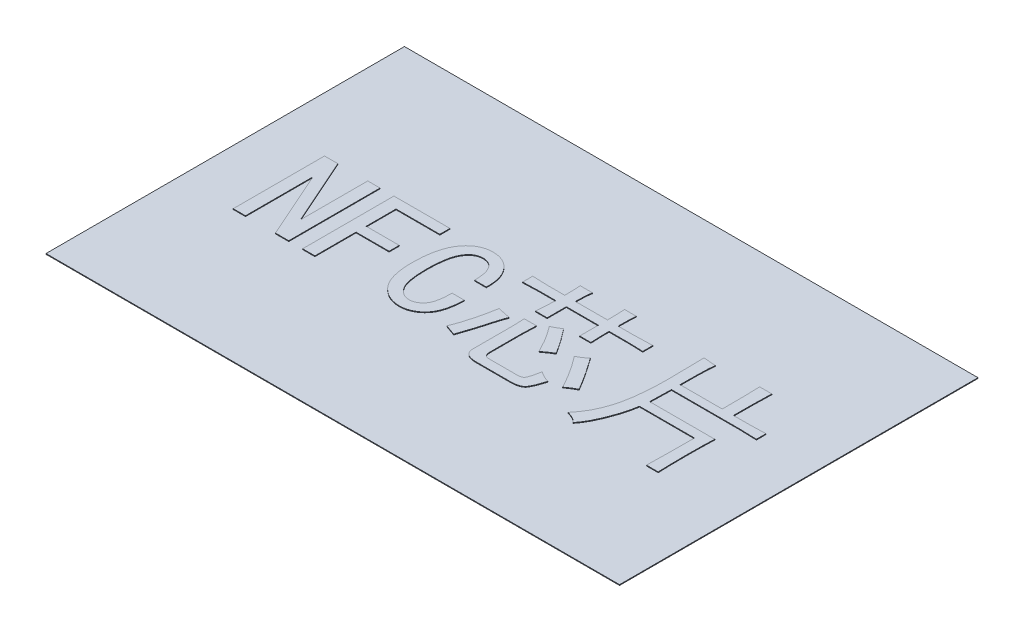
from build123d import *

# Parameters (mm, degrees)
SKETCH_1_W      = 80
SKETCH_1_H      = 50
EXTRUDE_1_DEPTH = 0.1
EXTRUDE_2_DEPTH = 0.1


with BuildPart() as part:
    # 草图1 → 凸台-拉伸1 (new body)
    with BuildSketch(Plane(origin=(0, 0, 0), x_dir=(1, 0, 0), z_dir=(0, 1, 0))):
        with Locations((40, -25)):
            Rectangle(SKETCH_1_W, SKETCH_1_H)
    extrude(amount=EXTRUDE_1_DEPTH)

    # 草图2 → 凸台-拉伸2 (add)
    with BuildSketch(Plane(origin=(0, 0.1, 0), x_dir=(1, 0, 0), z_dir=(0, 1, 0))):
        Polygon((15.488715278, -31.627687926), (13.62715491, -31.627687926), (9.5317221, -22.394348501), (9.457259686, -22.394348501), (9.457259686, -31.627687926), (7.744624147, -31.627687926), (7.744624147, -18.89461501), (9.606184515, -18.89461501), (13.701617325, -28.127954435), (13.776079739, -28.127954435), (13.776079739, -18.89461501), (15.488715278, -18.89461501), align=None)
        Polygon((25.243291606, -20.309400889), (19.137373599, -20.309400889), (19.137373599, -24.479296114), (23.754043311, -24.479296114), (23.754043311, -25.894081993), (19.137373599, -25.894081993), (19.137373599, -31.627687926), (17.42473806, -31.627687926), (17.42473806, -18.89461501), (25.243291606, -18.89461501), align=None)
        with BuildLine():
            add(Edge.make_bspline(
                [(34.923405519, -26.564243726), (34.913857462, -26.791460973), (34.895420979, -27.230198121), (34.829895413, -27.862190697), (34.732211137, -28.443068093), (34.600634036, -28.972835897), (34.435962132, -29.452556673), (34.2385183, -29.882743661), (34.006608285, -30.261132949), (33.74177677, -30.587187998), (33.451938828, -30.864598328), (33.151947009, -31.110043596), (32.835369864, -31.313750998), (32.507457028, -31.486389748), (32.161794857, -31.613761043), (31.80388749, -31.709313148), (31.431854495, -31.765084598), (31.17932293, -31.772735756), (31.051359954, -31.776612756)],
                knots=[0, 0, 0, 0, 1.494742256, 2.886219951, 4.173809575, 5.363956482, 6.470526693, 7.503352352, 8.469361244, 9.380145438, 10.256246157, 11.102836884, 11.924181916, 12.726930422, 13.533966696, 14.340165361, 15.1589274, 16, 16, 16, 16], degree=3))
            add(Edge.make_bspline(
                [(31.051359954, -31.776612756), (30.904895704, -31.772771261), (30.615805516, -31.765188942), (30.191476375, -31.692928182), (29.782033129, -31.580549345), (29.390724056, -31.418997258), (29.012976499, -31.216129126), (28.654890641, -30.964030415), (28.314722051, -30.664883069), (27.986470319, -30.326762704), (27.687387638, -29.934712938), (27.430771498, -29.485071058), (27.211800966, -28.982337137), (27.038875313, -28.423854033), (26.900396079, -27.812551757), (26.803878481, -27.14680976), (26.741852627, -26.426608894), (26.735712722, -25.928232707), (26.7325399, -25.670694749)],
                knots=[0, 0, 0, 0, 0.834912197, 1.647944286, 2.448293278, 3.25272125, 4.057593572, 4.889800151, 5.744779857, 6.638682353, 7.574302, 8.549391203, 9.585101031, 10.696366523, 11.879553958, 13.157474301, 14.531113079, 16, 16, 16, 16], degree=3))
            add(Edge.make_bspline(
                [(26.7325399, -25.670694749), (26.736020783, -25.38837311), (26.742763634, -24.841485298), (26.800868705, -24.048657745), (26.896735533, -23.312078552), (27.025987051, -22.629899864), (27.20079474, -22.005306529), (27.407806169, -21.432872596), (27.65901477, -20.918296799), (27.947068595, -20.458891977), (28.267652076, -20.057905475), (28.60713458, -19.704512979), (28.974930329, -19.412196611), (29.359708521, -19.164444747), (29.770573459, -18.976663991), (30.203512661, -18.843517921), (30.657571288, -18.761612285), (30.968283122, -18.751047042), (31.125822368, -18.74569018)],
                knots=[0, 0, 0, 0, 1.47527999, 2.857778281, 4.151479961, 5.355606635, 6.48275776, 7.537632238, 8.53243139, 9.469452065, 10.365307734, 11.211246795, 12.024566517, 12.814930656, 13.597414655, 14.376958224, 15.177074222, 16, 16, 16, 16], degree=3))
            add(Edge.make_bspline(
                [(31.125822368, -18.74569018), (31.259331106, -18.74927784), (31.52212589, -18.756339686), (31.907755315, -18.815825614), (32.275387121, -18.91254009), (32.627171293, -19.044868766), (32.959430332, -19.220716966), (33.274362056, -19.433827452), (33.572478882, -19.684727125), (33.849198441, -19.972852323), (34.10030551, -20.295878075), (34.320726355, -20.65035987), (34.498860607, -21.039463141), (34.643023241, -21.458810009), (34.749537015, -21.909742895), (34.820179246, -22.391324676), (34.856826195, -22.903994762), (34.85162315, -23.255674833), (34.848943104, -23.436822308)],
                knots=[0, 0, 0, 0, 0.945956135, 1.861993012, 2.758160538, 3.636767115, 4.519928897, 5.416356982, 6.327443843, 7.276805287, 8.242661636, 9.222809965, 10.22861537, 11.269278515, 12.361406108, 13.507821131, 14.716299423, 16, 16, 16, 16], degree=3))
            Line((34.848943104, -23.436822308), (33.210769981, -23.436822308))
            add(Edge.make_bspline(
                [(33.210769981, -23.436822308), (33.209283385, -23.304407701), (33.206410615, -23.04852313), (33.181493119, -22.676586118), (33.139748552, -22.330740642), (33.087682562, -22.009148313), (33.010393786, -21.715387949), (32.925884595, -21.444048868), (32.816252734, -21.200713687), (32.695668408, -20.980583563), (32.557990602, -20.786035185), (32.401752936, -20.618583478), (32.229343315, -20.476643754), (32.040732764, -20.359219978), (31.833857253, -20.270976702), (31.612346125, -20.208100944), (31.374530046, -20.168184166), (31.210561468, -20.163102348), (31.125822368, -20.16047606)],
                knots=[0, 0, 0, 0, 1.447060158, 2.796371029, 4.07121282, 5.253842581, 6.352813545, 7.388565209, 8.355623335, 9.26412738, 10.128389993, 10.952966403, 11.759535034, 12.562529072, 13.372531918, 14.208837792, 15.074325855, 16, 16, 16, 16], degree=3))
            add(Edge.make_bspline(
                [(31.125822368, -20.16047606), (31.029011668, -20.164088534), (30.838197872, -20.171208716), (30.560041293, -20.230575695), (30.298054825, -20.328942809), (30.048743495, -20.46222568), (29.816487139, -20.638133619), (29.601023894, -20.852586715), (29.400776027, -21.1045337), (29.215200393, -21.395679911), (29.049070526, -21.732804812), (28.906025501, -22.120131682), (28.786591659, -22.559691023), (28.688445952, -23.051845075), (28.612588704, -23.595205469), (28.558364109, -24.190645266), (28.52537353, -24.838363326), (28.521597906, -25.288229433), (28.519637853, -25.52176992)],
                knots=[0, 0, 0, 0, 0.702271953, 1.384177325, 2.053558723, 2.728373715, 3.429090246, 4.160530408, 4.929691837, 5.760909872, 6.662226506, 7.652627398, 8.753591582, 9.965523965, 11.293414481, 12.734409524, 14.304723168, 16, 16, 16, 16], degree=3))
            add(Edge.make_bspline(
                [(28.519637853, -25.52176992), (28.521596446, -25.736927624), (28.525365492, -26.150969641), (28.558278508, -26.746348464), (28.612615797, -27.292190469), (28.68797312, -27.787960129), (28.786930297, -28.235036927), (28.906022888, -28.632604584), (29.048664624, -28.980923695), (29.215534257, -29.280373422), (29.402383849, -29.534742073), (29.598901027, -29.756039084), (29.809504745, -29.941621627), (30.03184869, -30.095963719), (30.268532082, -30.215593561), (30.517869035, -30.301752662), (30.780858253, -30.352678917), (30.960127605, -30.358741536), (31.051359954, -30.361826876)],
                knots=[0, 0, 0, 0, 1.695965335, 3.263656815, 4.698586284, 6.018671717, 7.214194339, 8.305339643, 9.286425595, 10.175404576, 11.000155583, 11.769871946, 12.504076626, 13.207599708, 13.897898414, 14.587702459, 15.281264647, 16, 16, 16, 16], degree=3))
            add(Edge.make_bspline(
                [(31.051359954, -30.361826876), (31.118675803, -30.360181663), (31.253527539, -30.35688586), (31.452186082, -30.315219707), (31.647611713, -30.254639619), (31.838155254, -30.169568629), (32.020784309, -30.055959534), (32.202593294, -29.924442034), (32.373991902, -29.761305607), (32.549309886, -29.580656115), (32.709640118, -29.35936981), (32.842080881, -29.09072796), (32.958731012, -28.779667853), (33.049041267, -28.423113385), (33.124522252, -28.022655667), (33.174638864, -27.576536203), (33.204396208, -27.08497277), (33.208586494, -26.742631748), (33.210769981, -26.564243726)],
                knots=[0, 0, 0, 0, 0.660928196, 1.324016798, 1.987351856, 2.671191622, 3.368874025, 4.099346338, 4.873489474, 5.6921189, 6.572789567, 7.547167455, 8.628526434, 9.834544533, 11.159025956, 12.633584625, 14.245818809, 16, 16, 16, 16], degree=3))
            Line((33.210769981, -26.564243726), (34.923405519, -26.564243726))
        make_face()
        with BuildLine():
            add(Edge.make_bspline(
                [(41.327173185, -18.969077424), (41.326045629, -18.754871808), (41.323887059, -18.344800596), (41.309613439, -17.758247124), (41.290104372, -17.227490759), (41.264716916, -16.893265571), (41.25271077, -16.735204983)],
                knots=[0, 0, 0, 0, 1.149734275, 2.201029726, 3.149237371, 4, 4, 4, 4], degree=3))
            Line((41.25271077, -16.735204983), (42.965346308, -16.735204983))
            add(Edge.make_bspline(
                [(42.965346308, -16.735204983), (42.941186205, -16.883877954), (42.8890439, -17.204743772), (42.852231445, -17.727627015), (42.818215598, -18.323288501), (42.817042287, -18.745618959), (42.816421479, -18.969077424)],
                knots=[0, 0, 0, 0, 0.806002438, 1.739513442, 2.803958259, 4, 4, 4, 4], degree=3))
            Line((42.816421479, -18.969077424), (47.284166362, -18.969077424))
            add(Edge.make_bspline(
                [(47.284166362, -18.969077424), (47.283084621, -18.722696455), (47.281042044, -18.257472289), (47.266734208, -17.601064604), (47.247985924, -17.02797831), (47.221767659, -16.674474234), (47.209703947, -16.511817739)],
                knots=[0, 0, 0, 0, 1.202339285, 2.270294216, 3.204117013, 4, 4, 4, 4], degree=3))
            Line((47.209703947, -16.511817739), (48.847877071, -16.511817739))
            add(Edge.make_bspline(
                [(48.847877071, -16.511817739), (48.842345864, -16.584438233), (48.830656742, -16.737907408), (48.812448877, -16.981349864), (48.803995577, -17.250024059), (48.791506238, -17.544105488), (48.783595856, -17.864061071), (48.779266198, -18.209746543), (48.771783687, -18.581111475), (48.772858137, -18.836695621), (48.773414656, -18.969077424)],
                knots=[0, 0, 0, 0, 0.710832898, 1.502205942, 2.382198482, 3.333912172, 4.375017415, 5.50563752, 6.708025486, 8, 8, 8, 8], degree=3))
            Line((48.773414656, -18.969077424), (50.783899854, -18.969077424))
            add(Edge.make_bspline(
                [(50.783899854, -18.969077424), (51.249145649, -18.965787152), (52.16801373, -18.959288811), (53.085880992, -18.915990371), (53.539009198, -18.89461501)],
                knots=[0, 0, 0, 0, 1.012649812, 2, 2, 2, 2], degree=3))
            Line((53.539009198, -18.89461501), (53.539009198, -20.309400889))
            add(Edge.make_bspline(
                [(53.539009198, -20.309400889), (53.323015196, -20.297484402), (52.882926548, -20.273204511), (52.20797865, -20.252894137), (51.505604342, -20.238466931), (51.027519622, -20.236129546), (50.783899854, -20.234938475)],
                knots=[0, 0, 0, 0, 0.941701369, 1.918720329, 2.939433014, 4, 4, 4, 4], degree=3))
            Line((50.783899854, -20.234938475), (48.773414656, -20.234938475))
            add(Edge.make_bspline(
                [(48.773414656, -20.234938475), (48.774608093, -20.465688664), (48.776952384, -20.918955549), (48.791364407, -21.584559947), (48.8115698, -22.222753736), (48.835950905, -22.63800184), (48.847877071, -22.84112299)],
                knots=[0, 0, 0, 0, 1.061879169, 2.085868982, 3.063691104, 4, 4, 4, 4], degree=3))
            Line((48.847877071, -22.84112299), (47.284166362, -22.84112299))
            Line((47.284166362, -22.84112299), (47.284166362, -20.234938475))
            Line((47.284166362, -20.234938475), (42.816421479, -20.234938475))
            Line((42.816421479, -20.234938475), (42.816421479, -22.915585404))
            Line((42.816421479, -22.915585404), (41.178248355, -22.915585404))
            add(Edge.make_bspline(
                [(41.178248355, -22.915585404), (41.201949892, -22.719938604), (41.251483914, -22.311054868), (41.295408881, -21.667746318), (41.32361565, -20.969712746), (41.325957934, -20.485936758), (41.327173185, -20.234938475)],
                knots=[0, 0, 0, 0, 0.880114875, 1.839358766, 2.878990995, 4, 4, 4, 4], degree=3))
            Line((41.327173185, -20.234938475), (39.018838328, -20.234938475))
            add(Edge.make_bspline(
                [(39.018838328, -20.234938475), (38.860711955, -20.236283272), (38.526024512, -20.239129646), (37.995577356, -20.254163981), (37.408947982, -20.275204852), (36.999128016, -20.297664181), (36.784965887, -20.309400889)],
                knots=[0, 0, 0, 0, 0.848878712, 1.796721432, 2.848619227, 4, 4, 4, 4], degree=3))
            Line((36.784965887, -20.309400889), (36.784965887, -18.89461501))
            add(Edge.make_bspline(
                [(36.784965887, -18.89461501), (36.989932148, -18.906385312), (37.386859779, -18.929179105), (37.964310985, -18.95022568), (38.503961559, -18.965038899), (38.851518894, -18.967765026), (39.018838328, -18.969077424)],
                knots=[0, 0, 0, 0, 1.102078905, 2.134232082, 3.101790691, 4, 4, 4, 4], degree=3))
            Line((39.018838328, -18.969077424), (41.327173185, -18.969077424))
        make_face()
        with BuildLine():
            add(Edge.make_bspline(
                [(43.039808723, -24.628220943), (43.018435396, -24.975605545), (42.975714936, -25.669948998), (42.968801104, -26.365570881), (42.965346308, -26.713168555)],
                knots=[0, 0, 0, 0, 1.000613171, 2, 2, 2, 2], degree=3))
            Line((42.965346308, -26.713168555), (42.965346308, -31.031988609))
            add(Edge.make_bspline(
                [(42.965346308, -31.031988609), (42.966916742, -31.102040287), (42.969875255, -31.234009487), (43.005689485, -31.417379444), (43.063260258, -31.57454673), (43.14606994, -31.702979834), (43.253204828, -31.805336725), (43.385119846, -31.877230199), (43.541144829, -31.918643778), (43.651796139, -31.923162101), (43.709970456, -31.925537585)],
                knots=[0, 0, 0, 0, 1.263118504, 2.379568078, 3.356679522, 4.26815605, 5.113463714, 6.004925496, 6.951100566, 8, 8, 8, 8], degree=3))
            Line((43.709970456, -31.925537585), (47.73094085, -31.925537585))
            add(Edge.make_bspline(
                [(47.73094085, -31.925537585), (47.812182317, -31.922173545), (47.963968795, -31.915888384), (48.174896189, -31.861165568), (48.348666619, -31.766394593), (48.465553561, -31.650570101), (48.542370139, -31.524572503), (48.596333328, -31.387048278), (48.661274083, -31.214341941), (48.722418277, -31.000668831), (48.78894612, -30.748842249), (48.857725001, -30.457459655), (48.925295796, -30.124873789), (48.972062231, -29.890246519), (48.996801901, -29.766127558)],
                knots=[0, 0, 0, 0, 1.053847, 1.968941867, 2.802626129, 3.59610996, 4.073175101, 4.709585492, 5.510221192, 6.469564932, 7.593053216, 8.893180518, 10.356477463, 12, 12, 12, 12], degree=3))
            add(Edge.make_bspline(
                [(48.996801901, -29.766127558), (49.120526093, -29.859626905), (49.36160996, -30.041815881), (49.753190102, -30.252574446), (50.148893911, -30.420411129), (50.424125039, -30.480817857), (50.56051261, -30.510751706)],
                knots=[0, 0, 0, 0, 1.062529231, 2.070400718, 3.04380962, 4, 4, 4, 4], degree=3))
            add(Edge.make_bspline(
                [(50.56051261, -30.510751706), (50.524271814, -30.630423164), (50.454327762, -30.861386818), (50.344892709, -31.191865674), (50.233091566, -31.493542088), (50.126961016, -31.768122364), (50.022293835, -32.016512919), (49.915728491, -32.235255185), (49.810274543, -32.426433829), (49.708017943, -32.595039555), (49.590813475, -32.74310556), (49.438215651, -32.861429665), (49.263214312, -32.966765423), (49.05598837, -33.048915037), (48.822497977, -33.115536287), (48.557448577, -33.155723764), (48.265881956, -33.189112852), (48.061083369, -33.190615402), (47.954328095, -33.191398635)],
                knots=[0, 0, 0, 0, 1.436384748, 2.77219543, 3.998352128, 5.131874273, 6.153845837, 7.093731288, 7.925601961, 8.661056428, 9.358769797, 10.079519817, 10.86555105, 11.699028945, 12.631767781, 13.649145698, 14.774571153, 16, 16, 16, 16], degree=3))
            Line((47.954328095, -33.191398635), (43.188733553, -33.191398635))
            add(Edge.make_bspline(
                [(43.188733553, -33.191398635), (43.048753746, -33.187280398), (42.786613116, -33.179568161), (42.419394916, -33.120482299), (42.105198955, -33.018994276), (41.847946857, -32.867467528), (41.643156272, -32.676589367), (41.502615669, -32.436979072), (41.414250849, -32.157759423), (41.405975928, -31.95659115), (41.401635599, -31.851075171)],
                knots=[0, 0, 0, 0, 1.319957272, 2.471888182, 3.497524551, 4.415152092, 5.267695558, 6.107977964, 7.007604163, 8, 8, 8, 8], degree=3))
            Line((41.401635599, -31.851075171), (41.401635599, -26.713168555))
            add(Edge.make_bspline(
                [(41.401635599, -26.713168555), (41.400475462, -26.5210258), (41.398227045, -26.148641383), (41.383884445, -25.608967825), (41.36396279, -25.105819158), (41.339136289, -24.78352452), (41.327173185, -24.628220943)],
                knots=[0, 0, 0, 0, 1.104884855, 2.141334457, 3.10436795, 4, 4, 4, 4], degree=3))
            Line((41.327173185, -24.628220943), (43.039808723, -24.628220943))
        make_face()
        with BuildLine():
            add(Edge.make_bspline(
                [(40.135774549, -25.52176992), (40.109630777, -25.582276705), (40.054164266, -25.710647632), (39.974509271, -25.918668478), (39.891764273, -26.153175327), (39.807802068, -26.415094406), (39.715529969, -26.702162523), (39.622201173, -27.016749516), (39.526361513, -27.359194132), (39.424600439, -27.726987427), (39.31890124, -28.118723346), (39.19892966, -28.529010318), (39.072815853, -28.95973729), (38.934876002, -29.410506168), (38.782365536, -29.88035064), (38.622329527, -30.371219905), (38.455448116, -30.882509808), (38.335452936, -31.227988097), (38.274214181, -31.404300682)],
                knots=[0, 0, 0, 0, 0.512500211, 1.087318185, 1.731671659, 2.446017088, 3.225985813, 4.076382186, 4.997424567, 5.991163352, 7.043833246, 8.15242088, 9.315051472, 10.533837692, 11.817896913, 13.156168043, 14.548668962, 16, 16, 16, 16], degree=3))
            add(Edge.make_bspline(
                [(38.274214181, -31.404300682), (38.026951356, -31.308750453), (37.53610847, -31.119073132), (37.034091213, -30.961339074), (36.784965887, -30.883063779)],
                knots=[0, 0, 0, 0, 1.007502942, 2, 2, 2, 2], degree=3))
            add(Edge.make_bspline(
                [(36.784965887, -30.883063779), (36.871499434, -30.676995203), (37.050249478, -30.251324829), (37.28785101, -29.577907472), (37.510223252, -28.853058117), (37.718656068, -28.091187734), (37.905764973, -27.319409089), (38.079163478, -26.568048161), (38.225335681, -25.848734427), (38.308270543, -25.378538411), (38.348676596, -25.149457846)],
                knots=[0, 0, 0, 0, 0.900500481, 1.860139878, 2.876046958, 3.955388507, 5.042552967, 6.076024608, 7.062634826, 8, 8, 8, 8], degree=3))
            add(Edge.make_bspline(
                [(38.348676596, -25.149457846), (38.645925137, -25.220371717), (39.238051234, -25.361633817), (39.837333324, -25.468533902), (40.135774549, -25.52176992)],
                knots=[0, 0, 0, 0, 1.004004189, 2, 2, 2, 2], degree=3))
        make_face()
        with BuildLine():
            add(Edge.make_bspline(
                [(50.709437439, -24.777145772), (50.968314526, -25.141071258), (51.488200512, -25.8719191), (52.244742892, -26.992112394), (52.978262672, -28.142944819), (53.450535929, -28.925822909), (53.687934028, -29.31935307)],
                knots=[0, 0, 0, 0, 0.986330857, 1.980783997, 2.984998548, 4, 4, 4, 4], degree=3))
            add(Edge.make_bspline(
                [(53.687934028, -29.31935307), (53.565083503, -29.38355172), (53.319115207, -29.512088676), (52.95921994, -29.725097914), (52.609886429, -29.958795773), (52.385439038, -30.128166152), (52.273148148, -30.212902047)],
                knots=[0, 0, 0, 0, 0.992394102, 1.986947031, 2.992870856, 4, 4, 4, 4], degree=3))
            add(Edge.make_bspline(
                [(52.273148148, -30.212902047), (52.06725875, -29.827457467), (51.652001328, -29.050055988), (50.954306824, -27.911113417), (50.197861936, -26.777385918), (49.647446485, -26.04237365), (49.369113974, -25.670694749)],
                knots=[0, 0, 0, 0, 0.971277354, 1.958965026, 2.967895274, 4, 4, 4, 4], degree=3))
            add(Edge.make_bspline(
                [(49.369113974, -25.670694749), (49.491429085, -25.607128051), (49.733983598, -25.481073394), (50.077739856, -25.26371058), (50.40603725, -25.033569766), (50.608610964, -24.862361037), (50.709437439, -24.777145772)],
                knots=[0, 0, 0, 0, 1.023789901, 2.030205917, 3.01957964, 4, 4, 4, 4], degree=3))
        make_face()
        with BuildLine():
            add(Edge.make_bspline(
                [(45.273681165, -23.064510234), (45.475786257, -23.322462057), (45.891457539, -23.852993793), (46.499521929, -24.696780456), (47.118055035, -25.604701711), (47.522981328, -26.238659588), (47.73094085, -26.564243726)],
                knots=[0, 0, 0, 0, 0.919048262, 1.890214472, 2.916469492, 4, 4, 4, 4], degree=3))
            add(Edge.make_bspline(
                [(47.73094085, -26.564243726), (47.486796539, -26.71613903), (47.001152796, -27.018284118), (46.543657052, -27.361554616), (46.316154971, -27.532255117)],
                knots=[0, 0, 0, 0, 1.005446131, 2, 2, 2, 2], degree=3))
            add(Edge.make_bspline(
                [(46.316154971, -27.532255117), (46.140965336, -27.192243751), (45.795900289, -26.522534961), (45.231814504, -25.562425839), (44.640407255, -24.658046685), (44.216610148, -24.089324124), (44.007820115, -23.809134381)],
                knots=[0, 0, 0, 0, 1.046044873, 2.060358904, 3.044406574, 4, 4, 4, 4], degree=3))
            add(Edge.make_bspline(
                [(44.007820115, -23.809134381), (44.137130514, -23.747834502), (44.38281007, -23.631369567), (44.724384522, -23.446223389), (45.019972929, -23.262050317), (45.192832238, -23.127460117), (45.273681165, -23.064510234)],
                knots=[0, 0, 0, 0, 1.166099719, 2.215497465, 3.165361041, 4, 4, 4, 4], degree=3))
        make_face()
        with BuildLine():
            add(Edge.make_bspline(
                [(60.315088938, -16.958592227), (60.302323653, -17.059630304), (60.273374199, -17.288767149), (60.245889956, -17.675358901), (60.221110004, -18.14517819), (60.203319654, -18.698744683), (60.187046119, -19.336739916), (60.17194113, -20.058369243), (60.168659724, -20.86373101), (60.167022638, -21.428177), (60.166164108, -21.724186769)],
                knots=[0, 0, 0, 0, 0.512302011, 1.161812164, 1.949180891, 2.879390327, 3.948149626, 5.160147448, 6.510709416, 8, 8, 8, 8], degree=3))
            Line((60.166164108, -21.724186769), (66.048694871, -21.724186769))
            add(Edge.make_bspline(
                [(66.048694871, -21.724186769), (66.048618926, -21.554118514), (66.048470732, -21.222255596), (66.049522853, -20.736865118), (66.045820921, -20.275387257), (66.043284831, -19.837805196), (66.040569651, -19.424124084), (66.037495427, -19.034349324), (66.035849197, -18.668447973), (66.029393232, -18.325573977), (66.024118196, -18.006577968), (66.018667151, -17.711483052), (66.012852954, -17.441221005), (66.00842658, -17.194789928), (65.999397562, -16.972366141), (65.991253596, -16.77287598), (65.983210122, -16.597275529), (65.977070629, -16.487912027), (65.974232456, -16.437355324)],
                knots=[0, 0, 0, 0, 1.543771864, 3.012441313, 4.406033331, 5.732868904, 6.984603636, 8.161237728, 9.271115898, 10.305994866, 11.274125412, 12.167165642, 12.985117777, 13.727984712, 14.404369883, 15.005710522, 15.540358555, 16, 16, 16, 16], degree=3))
            Line((65.974232456, -16.437355324), (67.686867995, -16.437355324))
            add(Edge.make_bspline(
                [(67.686867995, -16.437355324), (67.684029822, -16.487912027), (67.677890328, -16.597275529), (67.669846855, -16.77287598), (67.661702889, -16.972366141), (67.65267387, -17.194789928), (67.648247497, -17.441221005), (67.6424333, -17.711483052), (67.636982255, -18.006577968), (67.631707219, -18.325573977), (67.625251253, -18.668447973), (67.623605024, -19.034349324), (67.6205308, -19.424124084), (67.61781562, -19.837805196), (67.61527953, -20.275387257), (67.611577598, -20.736865118), (67.612629719, -21.222255596), (67.612481524, -21.554118514), (67.61240558, -21.724186769)],
                knots=[0, 0, 0, 0, 0.459641445, 0.994289478, 1.595630117, 2.272015288, 3.014882223, 3.832834358, 4.725874588, 5.694005134, 6.728884102, 7.838762272, 9.015396364, 10.267131096, 11.593966669, 12.987558687, 14.456228136, 16, 16, 16, 16], degree=3))
            add(Edge.make_bspline(
                [(67.61240558, -21.724186769), (67.842230185, -21.724732179), (68.289017009, -21.725792474), (68.940776957, -21.71831808), (69.554880754, -21.713973208), (70.132213944, -21.705922087), (70.671791569, -21.693638756), (71.174762551, -21.684905308), (71.639831633, -21.666739681), (71.937661361, -21.655230589), (72.080150463, -21.649724354)],
                knots=[0, 0, 0, 0, 1.234304052, 2.399528918, 3.500572412, 4.532556897, 5.500452773, 6.399243117, 7.234158348, 8, 8, 8, 8], degree=3))
            Line((72.080150463, -21.649724354), (72.080150463, -22.990047819))
            add(Edge.make_bspline(
                [(72.080150463, -22.990047819), (71.948682492, -22.984769745), (71.694005728, -22.974545181), (71.326444408, -22.955919167), (70.986161475, -22.946891929), (70.674593687, -22.93478161), (70.390528092, -22.926183695), (70.134916956, -22.922105004), (69.906990542, -22.914239061), (69.764466744, -22.915154385), (69.697353192, -22.915585404)],
                knots=[0, 0, 0, 0, 1.324494882, 2.565781351, 3.704632434, 4.750996138, 5.704568512, 6.56539506, 7.324453637, 8, 8, 8, 8], degree=3))
            Line((69.697353192, -22.915585404), (60.166164108, -22.915585404))
            add(Edge.make_bspline(
                [(60.166164108, -22.915585404), (60.164911252, -23.154607739), (60.16237644, -23.638204271), (60.147579848, -24.373659403), (60.126961499, -25.127608822), (60.103541429, -25.636711324), (60.091701693, -25.894081993)],
                knots=[0, 0, 0, 0, 0.962609556, 1.947578005, 2.962422657, 4, 4, 4, 4], degree=3))
            Line((60.091701693, -25.894081993), (69.176116289, -25.894081993))
            add(Edge.make_bspline(
                [(69.176116289, -25.894081993), (69.164173442, -26.189144623), (69.13958618, -26.79660294), (69.119471221, -27.737184253), (69.105127538, -28.732802016), (69.102831304, -29.415872501), (69.101653874, -29.766127558)],
                knots=[0, 0, 0, 0, 0.914935357, 1.883617359, 2.914791752, 4, 4, 4, 4], degree=3))
            add(Edge.make_bspline(
                [(69.101653874, -29.766127558), (69.102841581, -30.120059548), (69.105173892, -30.815079642), (69.119706786, -31.839191121), (69.139865838, -32.825720796), (69.164193072, -33.470889242), (69.176116289, -33.787097953)],
                knots=[0, 0, 0, 0, 1.056011232, 2.073700735, 3.055885928, 4, 4, 4, 4], degree=3))
            Line((69.176116289, -33.787097953), (67.537943165, -33.787097953))
            add(Edge.make_bspline(
                [(67.537943165, -33.787097953), (67.540753333, -33.708960208), (67.546670863, -33.54442111), (67.554896962, -33.28517798), (67.562889874, -33.002029864), (67.572105646, -32.69502584), (67.576501594, -32.364036067), (67.58229306, -32.009196855), (67.587789525, -31.63044829), (67.593061316, -31.228716752), (67.599530714, -30.803103108), (67.601207466, -30.353551387), (67.604261733, -29.879201164), (67.606975252, -29.380945673), (67.609527981, -28.858789175), (67.613222122, -28.313655176), (67.612187495, -27.744610351), (67.612331856, -27.35759001), (67.61240558, -27.159943043)],
                knots=[0, 0, 0, 0, 0.56624743, 1.192379445, 1.878401933, 2.617664183, 3.416685835, 4.275618049, 5.187804951, 6.159904165, 7.185259355, 8.27046681, 9.4155915, 10.62063353, 11.878935495, 13.197154961, 14.568618329, 16, 16, 16, 16], degree=3))
            Line((67.61240558, -27.159943043), (59.942776864, -27.159943043))
            add(Edge.make_bspline(
                [(59.942776864, -27.159943043), (59.898598467, -27.429094401), (59.807022058, -27.987012214), (59.592231333, -28.839111248), (59.313185066, -29.737010704), (59.038994086, -30.507117955), (58.78871722, -31.126463319), (58.593590759, -31.576938644), (58.390575535, -32.003010445), (58.179186893, -32.405519133), (57.963310452, -32.78589187), (57.735608284, -33.141439162), (57.506046346, -33.476241865), (57.342283144, -33.684947741), (57.262129934, -33.787097953)],
                knots=[0, 0, 0, 0, 1.359867554, 2.818838962, 4.377889257, 6.048584801, 6.894031989, 7.709198822, 8.496702555, 9.247304616, 9.976368746, 10.677205946, 11.352564021, 12, 12, 12, 12], degree=3))
            add(Edge.make_bspline(
                [(57.262129934, -33.787097953), (57.228628366, -33.738132353), (57.159446737, -33.637017089), (57.023767442, -33.503278097), (56.866552256, -33.37555381), (56.681542175, -33.259765951), (56.472218629, -33.152480744), (56.236189616, -33.057157071), (55.976606713, -32.96844136), (55.793429463, -32.919127205), (55.698419225, -32.893548977)],
                knots=[0, 0, 0, 0, 0.771174847, 1.592496544, 2.469534411, 3.406253117, 4.429088292, 5.529770222, 6.718743076, 8, 8, 8, 8], degree=3))
            add(Edge.make_bspline(
                [(55.698419225, -32.893548977), (55.80161279, -32.769441453), (56.006855047, -32.522603307), (56.292321036, -32.138576438), (56.561052505, -31.749203687), (56.809989706, -31.352441807), (57.035286324, -30.946386292), (57.242510456, -30.535226635), (57.431115622, -30.11781225), (57.65467613, -29.549095918), (57.899756306, -28.816895725), (58.138434159, -27.910083754), (58.326417418, -26.970626149), (58.46254054, -25.998748062), (58.554283236, -24.993270301), (58.62802389, -23.957132721), (58.668978629, -22.888341328), (58.67424388, -22.165477642), (58.676915814, -21.798649184)],
                knots=[0, 0, 0, 0, 0.659290441, 1.31126644, 1.954015256, 2.59176326, 3.223924524, 3.850404205, 4.472353411, 5.094438672, 6.346204214, 7.624274183, 8.922790191, 10.258038413, 11.631388968, 13.046873983, 14.501390118, 16, 16, 16, 16], degree=3))
            add(Edge.make_bspline(
                [(58.676915814, -21.798649184), (58.675627404, -21.415301549), (58.67297945, -20.627440941), (58.658151122, -19.413047105), (58.637257198, -18.133329283), (58.614248604, -17.258263909), (58.602453399, -16.809667398)],
                knots=[0, 0, 0, 0, 0.921939741, 1.894781494, 2.920773571, 4, 4, 4, 4], degree=3))
            add(Edge.make_bspline(
                [(58.602453399, -16.809667398), (58.731164926, -16.821491995), (58.997787723, -16.84598636), (59.412053127, -16.886589584), (59.854599319, -16.920021416), (60.158828436, -16.945503779), (60.315088938, -16.958592227)],
                knots=[0, 0, 0, 0, 0.902231142, 1.868949853, 2.905433614, 4, 4, 4, 4], degree=3))
        make_face()
    extrude(amount=EXTRUDE_2_DEPTH)


solid = part.part
